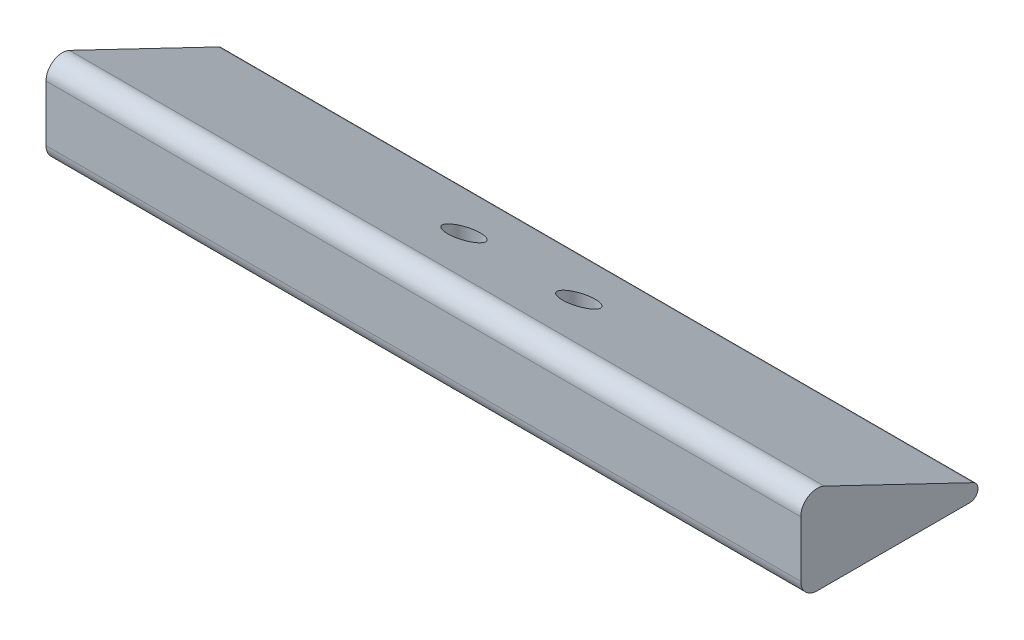
from build123d import *

# Parameters (mm, degrees)
BOSS_EXTRUDE1_DEPTH = 92
SKETCH2_R           = 2
CUT_EXTRUDE1_DEPTH  = 8
SKETCH3_R           = 1.5
CUT_EXTRUDE2_DEPTH  = 95.913794592


with BuildPart() as part:
    # Sketch1 → Boss-Extrude1 (new body)
    with BuildSketch(Plane(origin=(0, 0, 0), x_dir=(0, 0, -1), z_dir=(1, 0, 0))):
        with BuildLine():
            Line((2, 0), (20.605762563, 0))
            ThreePointArc((20.605762563, 0), (21.580832575, 0.778102566), (21.03849363, 1.901523057))
            Line((21.03849363, 1.901523057), (2.865462135, 10.624578175))
            ThreePointArc((2.865462135, 10.624578175), (0.934853125, 10.514299657), (0, 8.82153206))
            Line((0, 8.82153206), (0, 2))
            ThreePointArc((0, 2), (0.585786438, 0.585786438), (2, 0))
        make_face()
    extrude(amount=BOSS_EXTRUDE1_DEPTH)

    # Sketch2 → Cut-Extrude1 (cut)
    with BuildSketch(Plane(origin=(0, 10, 0), x_dir=(1, 0, 0), z_dir=(0, 1, 0))):
        with Locations(Location((39, 11.951977883, 0), (0, 0, 270))):
            Circle(SKETCH2_R)
        with Locations(Location((53, 11.951977883, 0), (0, 0, 270))):
            Circle(SKETCH2_R)
    extrude(amount=-CUT_EXTRUDE1_DEPTH, mode=Mode.SUBTRACT)

    # Sketch3 → Cut-Extrude2 (cut, through all)
    with BuildSketch(Plane(origin=(0, 2, 0), x_dir=(1, 0, 0), z_dir=(0, 1, 0))):
        with Locations(Location((39, 11.951977883, 0), (0, 0, 270))):
            Circle(SKETCH3_R)
        with Locations(Location((53, 11.951977883, 0), (0, 0, 270))):
            Circle(SKETCH3_R)
    extrude(amount=-CUT_EXTRUDE2_DEPTH, mode=Mode.SUBTRACT)


solid = part.part
